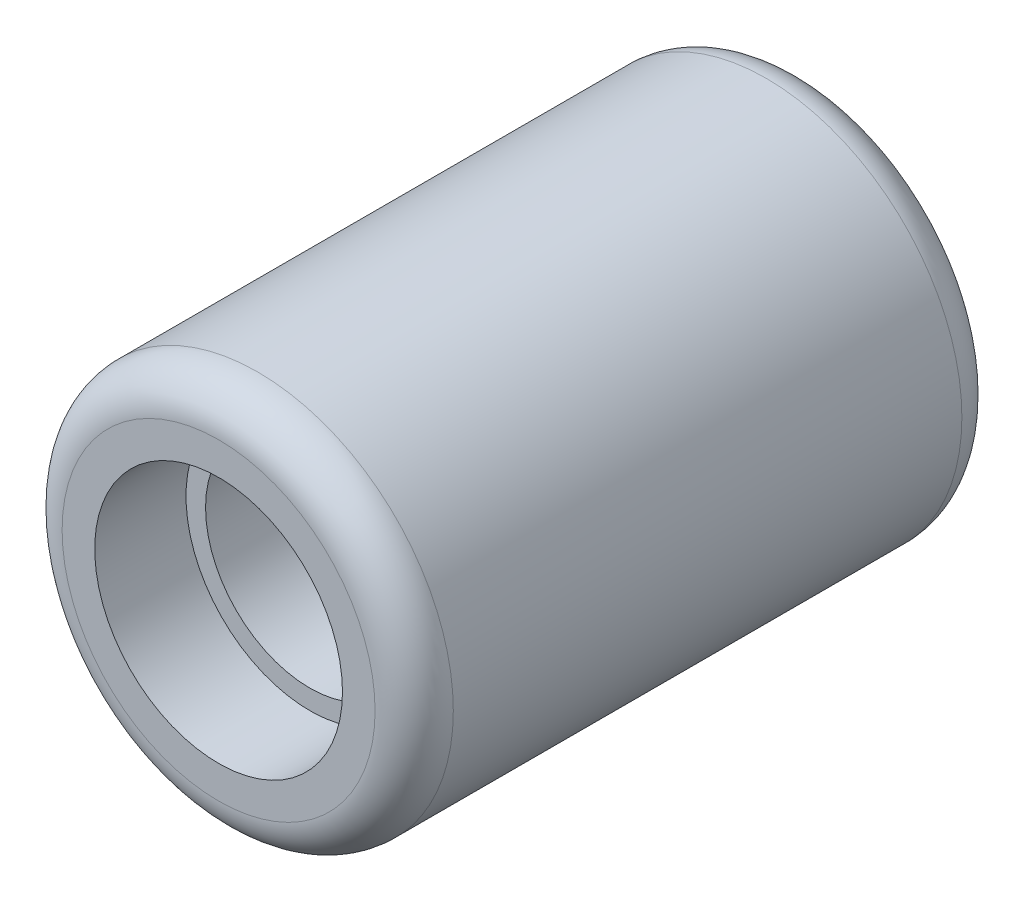
from build123d import *

# Parameters (mm, degrees)
ESQUISSE1_R             = 15
BOSS_EXTRU_1_DEPTH      = 45
ESQUISSE4_R             = 9.5
ENL_V_MAT_EXTRU_3_DEPTH = 7
ENL_V_START             = -7
ESQUISSE5_R             = 9.5
ENL_V_MAT_EXTRU_4_DEPTH = 7
ESQUISSE6_R             = 8
ENL_V_MAT_EXTRU_5_DEPTH = 60
CONG_1_R                = 3


with BuildPart() as part:
    # Esquisse1 → Boss.-Extru.1 (new body)
    with BuildSketch(Plane.XY):
        with Locations(Location((0, 0, 0), (0, 0, 180))):
            Circle(ESQUISSE1_R)
    extrude(amount=BOSS_EXTRU_1_DEPTH)

    # Esquisse4 → Enlèv. mat.-Extru.3 (cut)
    with BuildSketch(Plane.XY.offset(45)):
        Circle(ESQUISSE4_R)
    extrude(amount=-ENL_V_MAT_EXTRU_3_DEPTH, mode=Mode.SUBTRACT)

    # Esquisse5 → Enlèv. mat.-Extru.4 (cut)
    with BuildSketch(Plane(origin=(0, 0, 0), x_dir=(-1, 0, 0), z_dir=(0, 0, -1)).offset(ENL_V_START)):
        with Locations(Location((0, 0, 0), (0, 0, 180))):
            Circle(ESQUISSE5_R)
    extrude(amount=ENL_V_MAT_EXTRU_4_DEPTH, mode=Mode.SUBTRACT)

    # Esquisse6 → Enlèv. mat.-Extru.5 (cut)
    with BuildSketch(Plane(origin=(0, 0, 7), x_dir=(-1, 0, 0), z_dir=(0, 0, -1))):
        Circle(ESQUISSE6_R)
    extrude(amount=-ENL_V_MAT_EXTRU_5_DEPTH, mode=Mode.SUBTRACT)

    # Congé1
    cong_1_edges = [part.edges().sort_by_distance(p)[0] for p in [
        (15, 0, 0),
        (15, 0, 45),
    ]]
    fillet(cong_1_edges, radius=CONG_1_R)


solid = part.part
